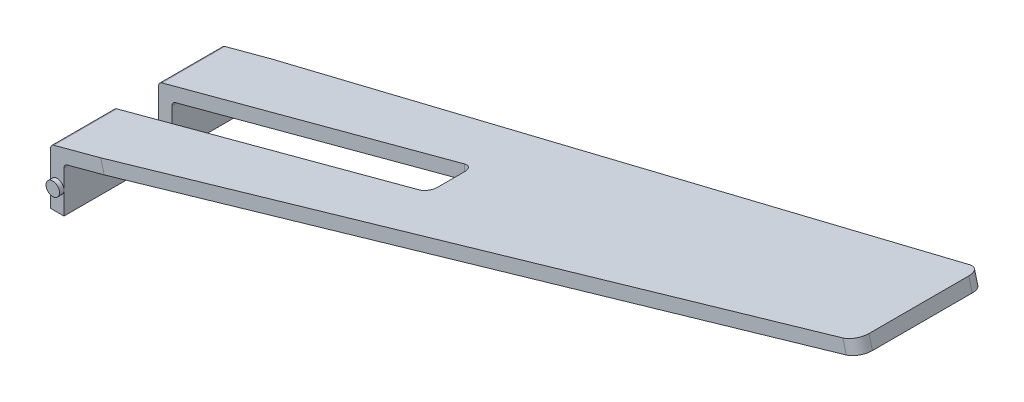
from build123d import *

# Parameters (mm, degrees)
BOSS_EXTRUDE1_DEPTH      = 3.8
CHAMFER1_SIZE            = 0.5
CHAMFER1_SIZE2           = 16.846754467
BOSS_EXTRUDE2_DEPTH      = 0.1
BOSS_EXTRUDE2_DEPTH_BACK = 3.9
SKETCH3_R                = 0.15
SKETCH4_W                = 7
SKETCH4_H                = 1
CUT_EXTRUDE2_DEPTH       = 10
FILLET1_R                = 0.1
FILLET2_R                = 0.3
FILLET3_R                = 0.2


with BuildPart() as part:
    # Sketch1 → Boss-Extrude1 (new body)
    with BuildSketch(Plane.XY):
        Polygon((0, 0), (0, 1.230198096), (17.386664873, 5.888940908), (17.464310587, 5.59916316), (0.3, 1), (0.3, 0), align=None)
    extrude(amount=BOSS_EXTRUDE1_DEPTH)

    # Chamfer1
    chamfer1_edges = [part.edges().sort_by_distance(p)[0] for p in [
        (17.42548773, 5.744052034, 3.8),
        (17.42548773, 5.744052034, 0),
    ]]
    chamfer1_side = [part.faces().sort_by_distance(p)[0] for p in [
        (17.42548773, 5.744052034, 1.9),
    ]]
    chamfer(chamfer1_edges, length=CHAMFER1_SIZE, length2=CHAMFER1_SIZE2, reference=chamfer1_side[0])

    # Sketch3 → Boss-Extrude2 (add, two sides: drawn at the far end of the back side and taken through both)
    with BuildSketch(Plane.XY.offset(3.8).offset(-BOSS_EXTRUDE2_DEPTH_BACK)):
        with Locations((0.15, 0.5)):
            Circle(SKETCH3_R)
    extrude(amount=BOSS_EXTRUDE2_DEPTH + BOSS_EXTRUDE2_DEPTH_BACK)

    # Sketch4 → Cut-Extrude2 (cut)
    with BuildSketch(Plane.XZ):
        with Locations((3.5, 1.9)):
            Rectangle(SKETCH4_W, SKETCH4_H)
    extrude(amount=-CUT_EXTRUDE2_DEPTH, mode=Mode.SUBTRACT)

    # Fillet1
    fillet1_edges = [part.edges().sort_by_distance(p)[0] for p in [
        (0, 1.230198096, 3.1),
        (0.3, 1, 3.1),
        (0, 1.230198096, 0.7),
        (0.3, 1, 0.7),
    ]]
    fillet(fillet1_edges, radius=FILLET1_R)

    # Fillet2
    fillet2_edges = [part.edges().sort_by_distance(p)[0] for p in [
        (17.42548773, 5.744052034, 0.5),
        (17.42548773, 5.744052034, 3.3),
    ]]
    fillet(fillet2_edges, radius=FILLET2_R)

    # Fillet3
    fillet3_edges = [part.edges().sort_by_distance(p)[0] for p in [
        (7, 2.950551016, 2.4),
        (7, 2.950551016, 1.4),
    ]]
    fillet(fillet3_edges, radius=FILLET3_R)


solid = part.part
